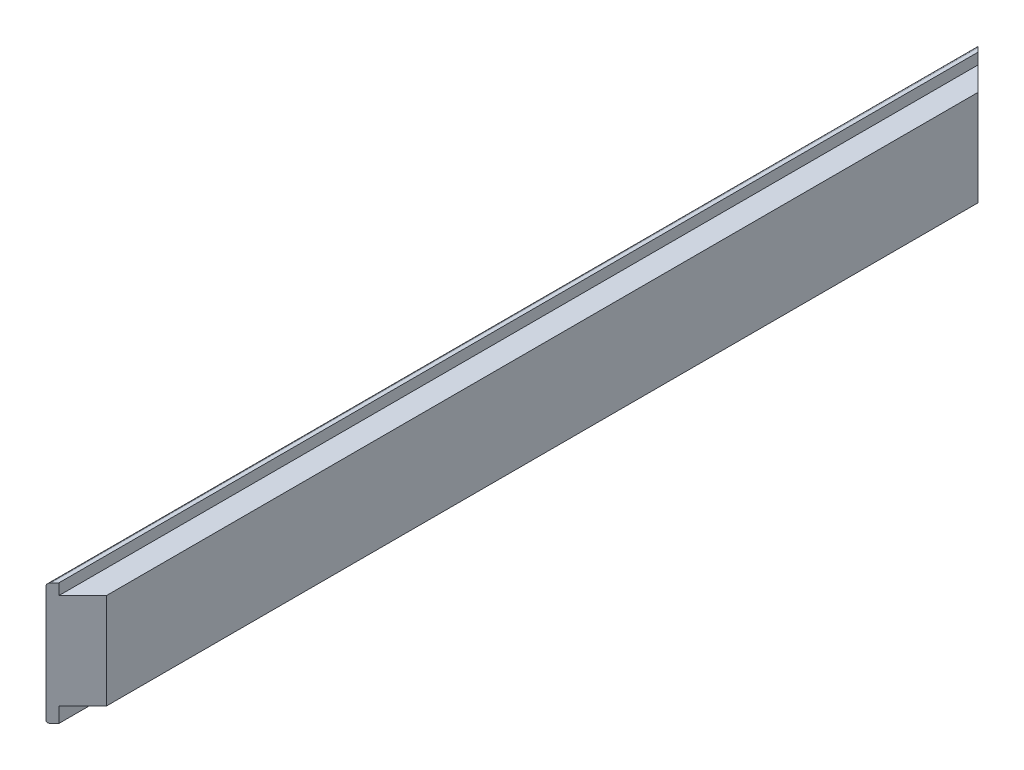
from build123d import *

# Parameters (mm, degrees)
BOSS_EXTRUDE1_DEPTH            = 294.550000053
FILLET1_R                      = 1.5875
CUT_EXTRUDE1_DEPTH             = 306.043611732
CUT_EXTRUDE1_DEPTH_BACK        = 306.043611732
F_7_9_7_9_DIAMETER_HOLE2_D     = 7.9
F_7_9_7_9_DIAMETER_HOLE2_DEPTH = 15
F_7_9_7_9_DIAMETER_HOLE2_TIP   = 2.373399445


with BuildPart() as part:
    # Sketch1 → Boss-Extrude1 (new, symmetric)
    with BuildSketch(Plane.XY):
        Polygon((0, 77.000000178), (0, 0), (4.050000028, 0), (4.050000028, 9.525), (19.05, 9.525), (19.05, 70.000000208), (4.050000028, 70.000000208), (4.050000028, 77.000000178), align=None)
    extrude(amount=BOSS_EXTRUDE1_DEPTH, both=True)

    # Fillet1
    fillet1_edges = [part.edges().sort_by_distance(p)[0] for p in [
        (0, 0, 0),
        (0, 77.000000178, 0),
    ]]
    fillet(fillet1_edges, radius=FILLET1_R)

    # Sketch2 → Cut-Extrude1 (cut, two sides: drawn at the far end of the back side and taken through both)
    with BuildSketch(Plane(origin=(0, 77.000000178, 0), x_dir=(1, 0, 0), z_dir=(0, 1, 0)).offset(-CUT_EXTRUDE1_DEPTH_BACK)):
        Polygon((0, 294.550000053), (19.05, 275.500000053), (19.05, 294.550000053), align=None)
        Polygon((19.05, -275.500000053), (19.05, -294.550000053), (0, -294.550000053), align=None)
    extrude(amount=CUT_EXTRUDE1_DEPTH + CUT_EXTRUDE1_DEPTH_BACK, mode=Mode.SUBTRACT)

    # Ø7.9 (7.9) Diameter Hole2
    with Locations(Plane.XZ.offset(-9.525)):
        with Locations((11.550000014, -104.550000053), (11.550000014, 104.550000053)):
            Hole(F_7_9_7_9_DIAMETER_HOLE2_D / 2, depth=F_7_9_7_9_DIAMETER_HOLE2_DEPTH)
            with Locations((0, 0, -(F_7_9_7_9_DIAMETER_HOLE2_DEPTH + F_7_9_7_9_DIAMETER_HOLE2_TIP / 2))):  # 118° drill point
                Cone(0, F_7_9_7_9_DIAMETER_HOLE2_D / 2, F_7_9_7_9_DIAMETER_HOLE2_TIP, mode=Mode.SUBTRACT)


solid = part.part
